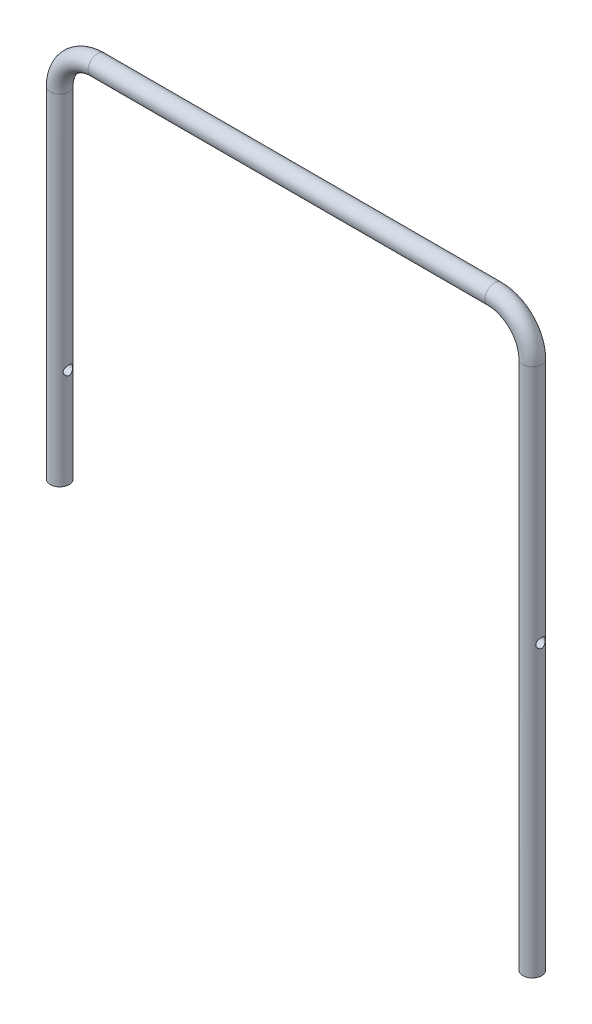
from build123d import *

# Parameters (mm, degrees)
CROQUIS2_R                 = 5
CORTAR_EXTRUIR2_DEPTH      = 328.223165581
CORTAR_EXTRUIR2_DEPTH_BACK = 328.223165581
CROQUIS4_R                 = 2.5


with BuildPart() as part:
    # Barrer1: sweep along a path in Croquis1
    with BuildLine(Plane.XY) as barrer1_path:
        Line((0, 0), (0, 180))
        ThreePointArc((0, 180), (5.857864376, 194.142135624), (20, 200))
        Line((20, 200), (230, 200))
        ThreePointArc((230, 200), (244.142135624, 194.142135624), (250, 180))
        Line((250, 180), (250, -100))
    # Croquis2 → Barrer1 (sweep)
    with BuildSketch(Plane(origin=(0, 0, 0), x_dir=(1, 0, 0), z_dir=(0, 1, 0))):
        Circle(CROQUIS2_R)
    sweep(path=barrer1_path.line)

    # Croquis4 → Cortar-Extruir2 (cut, two sides: drawn at the far end of the back side and taken through both)
    with BuildSketch(Plane(origin=(0, 0, 0), x_dir=(0, 0, -1), z_dir=(1, 0, 0)).offset(-CORTAR_EXTRUIR2_DEPTH_BACK)):
        with Locations((0, 52.5)):
            Circle(CROQUIS4_R)
    extrude(amount=CORTAR_EXTRUIR2_DEPTH + CORTAR_EXTRUIR2_DEPTH_BACK, mode=Mode.SUBTRACT)


solid = part.part
